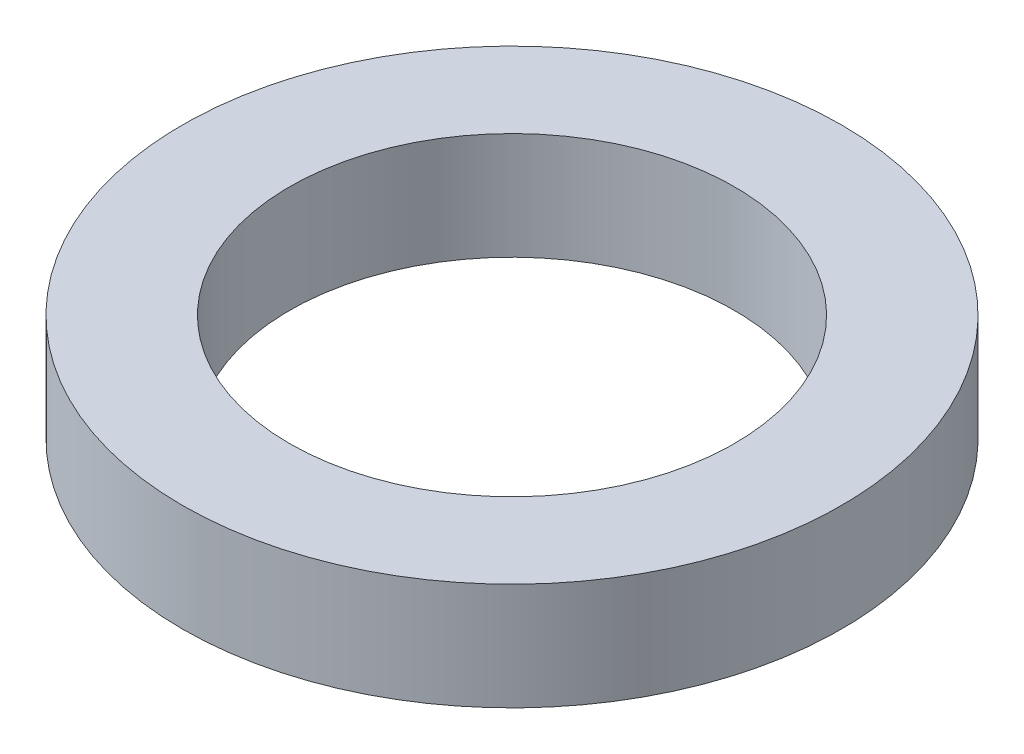
from build123d import *

# Parameters (mm, degrees)
SKETCH_1_R      = 4
SKETCH_1_R_2    = 2.7
EXTRUDE_1_DEPTH = 1.3


with BuildPart() as part:
    # 草图1 → 凸台-拉伸1 (new body)
    with BuildSketch(Plane(origin=(0, 0, 0), x_dir=(1, 0, 0), z_dir=(0, 1, 0))):
        with Locations(Location((0, 0, 0), (0, 0, 270))):
            Circle(SKETCH_1_R)
        with Locations(Location((0, 0, 0), (0, 0, 270))):
            Circle(SKETCH_1_R_2, mode=Mode.SUBTRACT)
    extrude(amount=EXTRUDE_1_DEPTH)


solid = part.part
